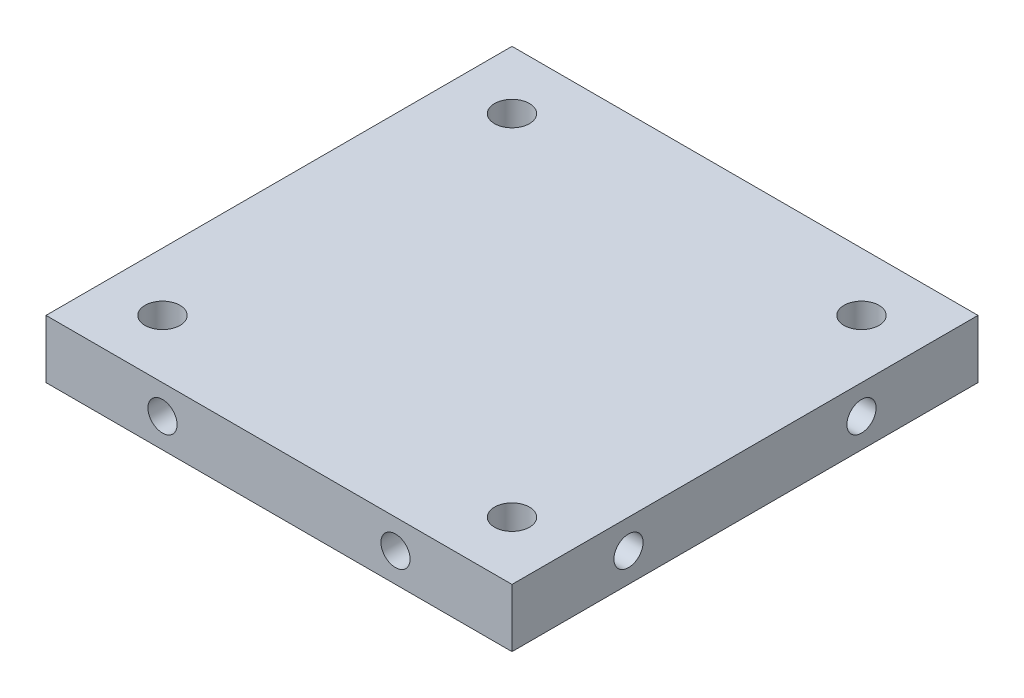
from build123d import *

# Parameters (mm, degrees)
SKETCH1_W           = 40
SKETCH1_H           = 40
BOSS_EXTRUDE1_DEPTH = 5
SKETCH2_R           = 1.25
CUT_EXTRUDE1_DEPTH  = 5
CIRPATTERN1_COUNT   = 4
SKETCH3_R           = 1.5
CUT_EXTRUDE3_DEPTH  = 10


with BuildPart() as part:
    # Sketch1 → Boss-Extrude1 (new body)
    with BuildSketch(Plane(origin=(0, 0, 0), x_dir=(1, 0, 0), z_dir=(0, 1, 0))):
        Rectangle(SKETCH1_W, SKETCH1_H)
    extrude(amount=BOSS_EXTRUDE1_DEPTH)

    # Sketch2 → Cut-Extrude1 (cut)
    with BuildSketch(Plane.XY.offset(20)):
        with Locations((-10, 2.5)):
            Circle(SKETCH2_R)
        with Locations(Location((10, 2.5, 0), (0, 0, 180))):
            Circle(SKETCH2_R)
    cut_extrude1 = extrude(amount=-CUT_EXTRUDE1_DEPTH, mode=Mode.SUBTRACT)

    # CirPattern1: Cut-Extrude1 ×4 about axis
    cirpattern1_axis = Axis((0, 0, 0), (0, 1, 0))
    for i in range(1, CIRPATTERN1_COUNT):
        add(cut_extrude1.rotate(cirpattern1_axis, i * 360 / CIRPATTERN1_COUNT), mode=Mode.SUBTRACT)

    # Sketch3 → Cut-Extrude3 (cut)
    with BuildSketch(Plane(origin=(0, 5, 0), x_dir=(1, 0, 0), z_dir=(0, 1, 0))):
        with Locations(Location((-15, 15, 0), (0, 0, 270))):
            Circle(SKETCH3_R)
        with Locations(Location((15, 15, 0), (0, 0, 270))):
            Circle(SKETCH3_R)
        with Locations(Location((15, -15, 0), (0, 0, 270))):
            Circle(SKETCH3_R)
        with Locations(Location((-15, -15, 0), (0, 0, 270))):
            Circle(SKETCH3_R)
    extrude(amount=-CUT_EXTRUDE3_DEPTH, mode=Mode.SUBTRACT)


solid = part.part
